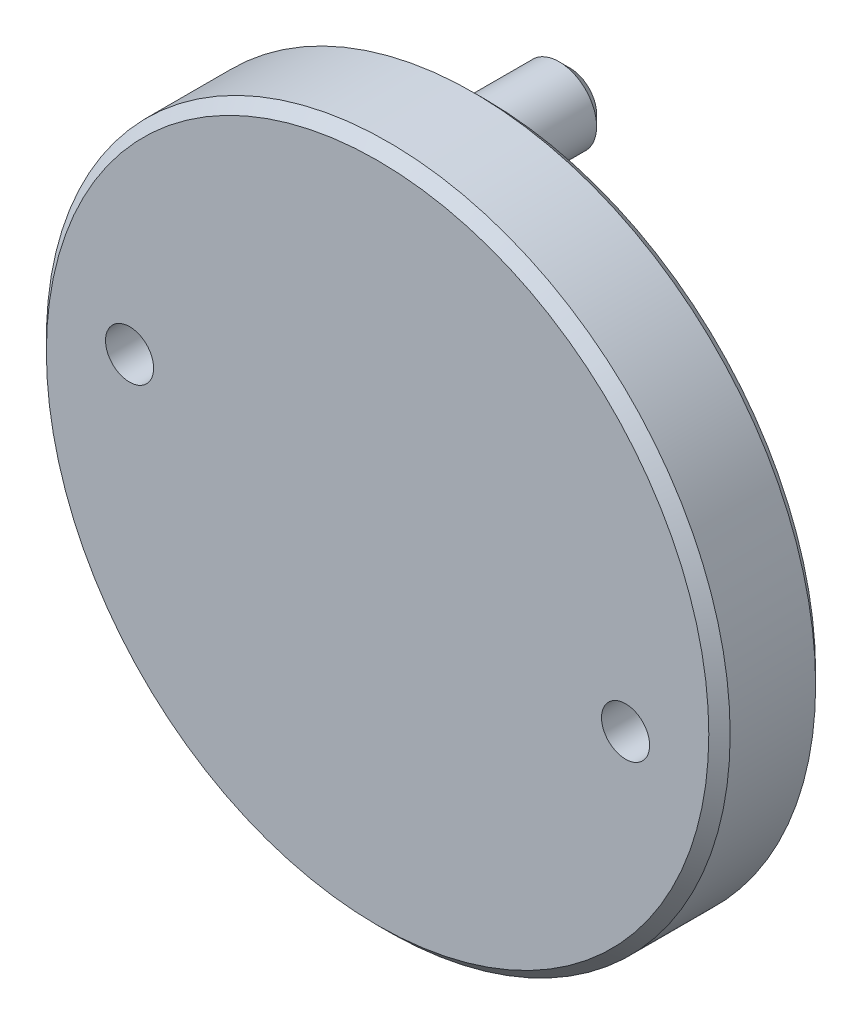
from build123d import *

# Parameters (mm, degrees)
SKETCH_1_R          = 3.5
EXTRUDE_1_DEPTH     = 5
FILLET_1_R          = 10
SKETCH_2_R          = 18
EXTRUDE_2_DEPTH     = 3
SKETCH_3_R          = 14
CUT_EXTRUDE_1_DEPTH = 32
SKETCH_4_R          = 16.75
CUT_EXTRUDE_2_DEPTH = 3
CHAMFER_1_SIZE      = 0.5
SKETCH_5_R          = 32
EXTRUDE_3_DEPTH     = 10
SKETCH_6_R          = 3.5
SKETCH_6_R_2        = 14
EXTRUDE_4_DEPTH     = 8
SKETCH_7_W          = 21.874500366
SKETCH_7_H          = 73.978344987
CUT_EXTRUDE_3_DEPTH = 62.5
CHAMFER_2_SIZE      = 1
CHAMFER_3_SIZE      = 1
SKETCH_8_R          = 2.25
CUT_EXTRUDE_4_DEPTH = 125
SKETCH_9_R          = 4
CUT_EXTRUDE_5_DEPTH = 4


with BuildPart() as part:
    # 草图1 → 凸台-拉伸1 (new body)
    with BuildSketch(Plane.XY):
        with BuildLine():
            Line((-11.5, 18.165902125), (-7.564716302, 29.602895938))
            ThreePointArc((-7.564716302, 29.602895938), (0, 35), (7.564716302, 29.602895938))
            Line((7.564716302, 29.602895938), (11.5, 18.165902125))
            ThreePointArc((11.5, 18.165902125), (18.619546181, 10.75), (21.482132723, 0.876341081))
            Line((21.482132723, 0.876341081), (29.419218059, -8.250211479))
            ThreePointArc((29.419218059, -8.250211479), (30.310889132, -17.5), (21.854501757, -21.352684459))
            Line((21.854501757, -21.352684459), (9.982132723, -19.042243206))
            ThreePointArc((9.982132723, -19.042243206), (0, -21.5), (-9.982132723, -19.042243206))
            Line((-9.982132723, -19.042243206), (-21.854501757, -21.352684459))
            ThreePointArc((-21.854501757, -21.352684459), (-30.310889132, -17.5), (-29.419218059, -8.250211479))
            Line((-29.419218059, -8.250211479), (-21.482132723, 0.876341081))
            ThreePointArc((-21.482132723, 0.876341081), (-18.619546181, 10.75), (-11.5, 18.165902125))
        make_face()
        with Locations((0, 27)):
            Circle(SKETCH_1_R, mode=Mode.SUBTRACT)
        with Locations((23.382685902, -13.5)):
            Circle(SKETCH_1_R, mode=Mode.SUBTRACT)
        with Locations((-23.382685902, -13.5)):
            Circle(SKETCH_1_R, mode=Mode.SUBTRACT)
    extrude(amount=EXTRUDE_1_DEPTH)

    # 圆角1
    fillet_1_edges = [part.edges().sort_by_distance(p)[0] for p in [
        (21.482132723, 0.876341081, 2.5),
        (9.982132723, -19.042243206, 2.5),
        (-9.982132723, -19.042243206, 2.5),
        (-21.482132723, 0.876341081, 2.5),
        (-11.5, 18.165902125, 2.5),
        (11.5, 18.165902125, 2.5),
    ]]
    fillet(fillet_1_edges, radius=FILLET_1_R)

    # 草图2 → 凸台-拉伸2 (add)
    with BuildSketch(Plane.XY.offset(5)):
        Circle(SKETCH_2_R)
    extrude(amount=EXTRUDE_2_DEPTH)

    # 草图3 → 切除-拉伸1 (cut)
    with BuildSketch(Plane.XY.offset(8)):
        Circle(SKETCH_3_R)
    extrude(amount=-CUT_EXTRUDE_1_DEPTH, mode=Mode.SUBTRACT)

    # 草图4 → 切除-拉伸2 (cut)
    with BuildSketch(Plane(origin=(0, 0, 0), x_dir=(-1, 0, 0), z_dir=(0, 0, -1))):
        Circle(SKETCH_4_R)
    extrude(amount=-CUT_EXTRUDE_2_DEPTH, mode=Mode.SUBTRACT)

    # 倒角1
    chamfer_1_edges = [part.edges().sort_by_distance(p)[0] for p in [
        (-18, 0, 8),
    ]]
    chamfer(chamfer_1_edges, length=CHAMFER_1_SIZE)

    # 草图7 → 切除-拉伸3 (cut, symmetric)
    with BuildSketch(Plane(origin=(0, 0, 0), x_dir=(0, 0, -1), z_dir=(1, 0, 0))):
        with Locations((-1.024921742, 9.171265754)):
            Rectangle(SKETCH_7_W, SKETCH_7_H)
    extrude(amount=CUT_EXTRUDE_3_DEPTH, both=True, mode=Mode.SUBTRACT)


with BuildPart() as body_2:
    # 草图5 → 凸台-拉伸3 (new body)
    with BuildSketch(Plane.XY.offset(8)):
        Circle(SKETCH_5_R)
    extrude(amount=EXTRUDE_3_DEPTH)

    # 草图6 → 凸台-拉伸4 (add)
    with BuildSketch(Plane(origin=(0, 0, 8), x_dir=(-1, 0, 0), z_dir=(0, 0, -1))):
        with Locations(Location((0, 27, 0), (0, 0, 180))):
            Circle(SKETCH_6_R)
        with Locations(Location((0, 0, 0), (0, 0, 180))):
            Circle(SKETCH_6_R_2)
    extrude(amount=EXTRUDE_4_DEPTH)

    # 倒角2
    chamfer_2_edges = [body_2.edges().sort_by_distance(p)[0] for p in [
        (-3.5, 27, 0),
        (-14, 0, 0),
    ]]
    chamfer(chamfer_2_edges, length=CHAMFER_2_SIZE)

    # 倒角3
    chamfer_3_edges = [body_2.edges().sort_by_distance(p)[0] for p in [
        (-32, 0, 8),
        (-32, 0, 18),
    ]]
    chamfer(chamfer_3_edges, length=CHAMFER_3_SIZE)

    # 草图8 → 切除-拉伸4 (cut)
    with BuildSketch(Plane(origin=(0, 0, 8), x_dir=(-1, 0, 0), z_dir=(0, 0, -1))):
        with Locations((-23.210676004, -3.676209928)):
            Circle(SKETCH_8_R)
        with Locations(Location((23.210676004, 3.676209928, 0), (0, 0, 180))):
            Circle(SKETCH_8_R)
    extrude(amount=-CUT_EXTRUDE_4_DEPTH, mode=Mode.SUBTRACT)

    # 草图9 → 切除-拉伸5 (cut)
    with BuildSketch(Plane(origin=(0, 0, 8), x_dir=(-1, 0, 0), z_dir=(0, 0, -1))):
        with Locations((-23.210676004, -3.676209928)):
            Circle(SKETCH_9_R)
        with Locations((23.210676004, 3.676209928)):
            Circle(SKETCH_9_R)
    extrude(amount=-CUT_EXTRUDE_5_DEPTH, mode=Mode.SUBTRACT)


solid = body_2.part
